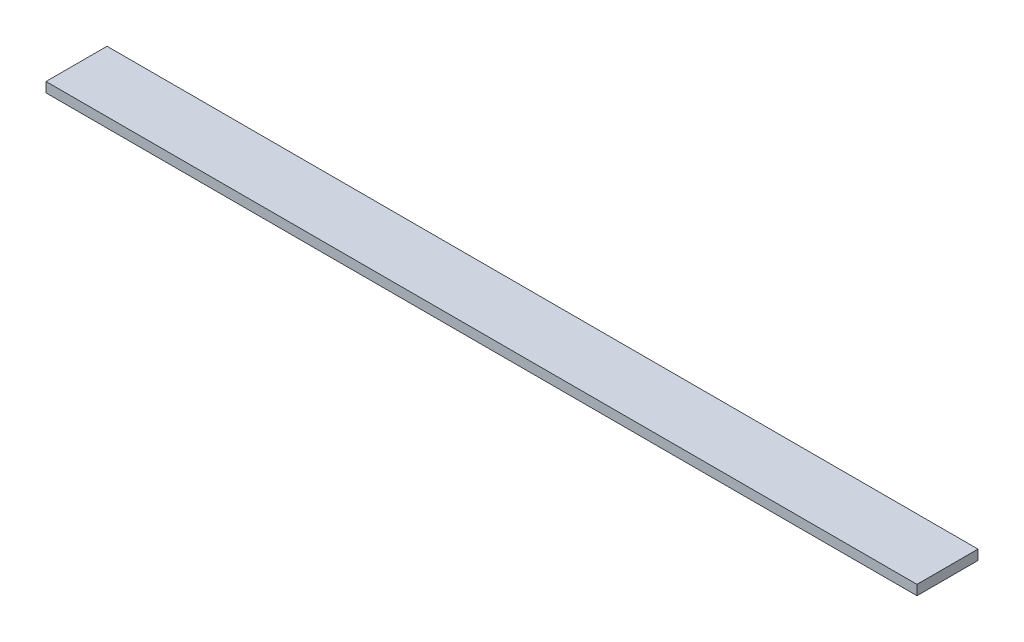
from build123d import *

# Parameters (mm, degrees)
SKETCH1_W           = 3352.8
SKETCH1_H           = 234.95
BOSS_EXTRUDE1_DEPTH = 38.1


with BuildPart() as part:
    # Sketch1 → Boss-Extrude1 (new body)
    with BuildSketch(Plane(origin=(0, 0, 0), x_dir=(1, 0, 0), z_dir=(0, 1, 0))):
        with Locations((364.144058501, 462.035054845)):
            Rectangle(SKETCH1_W, SKETCH1_H)
    extrude(amount=BOSS_EXTRUDE1_DEPTH)


solid = part.part
